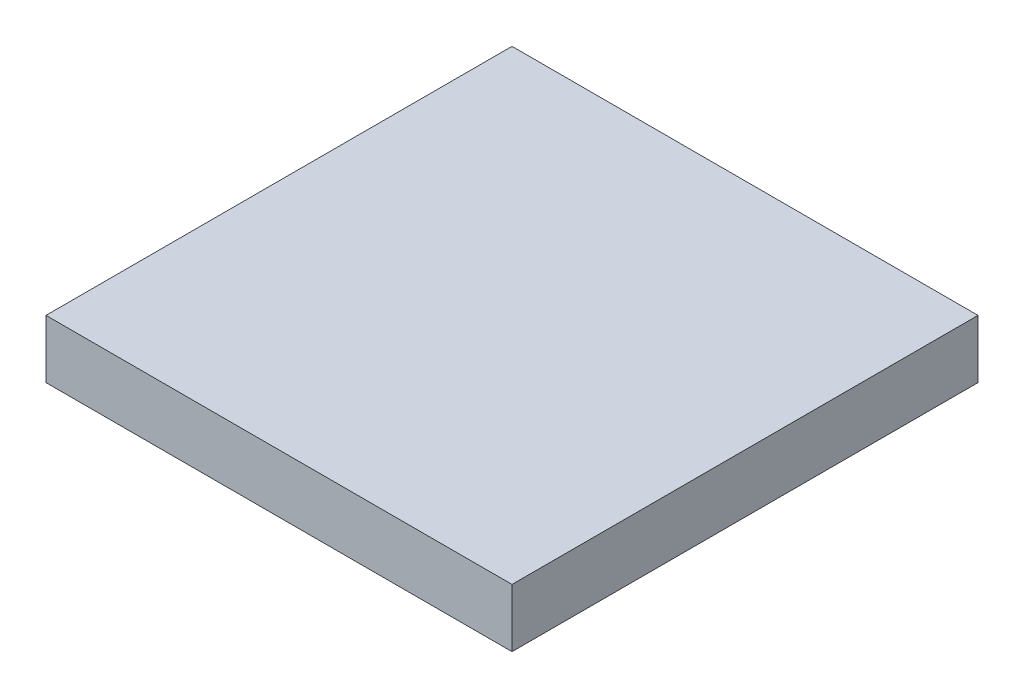
from build123d import *

# Parameters (mm, degrees)
SKETCH1_W           = 200
SKETCH1_H           = 200
BOSS_EXTRUDE1_DEPTH = 25


with BuildPart() as part:
    # Sketch1 → Boss-Extrude1 (new body)
    with BuildSketch(Plane(origin=(0, 0, 0), x_dir=(1, 0, 0), z_dir=(0, 1, 0))):
        with Locations((0, 100)):
            Rectangle(SKETCH1_W, SKETCH1_H)
    extrude(amount=BOSS_EXTRUDE1_DEPTH)


solid = part.part
